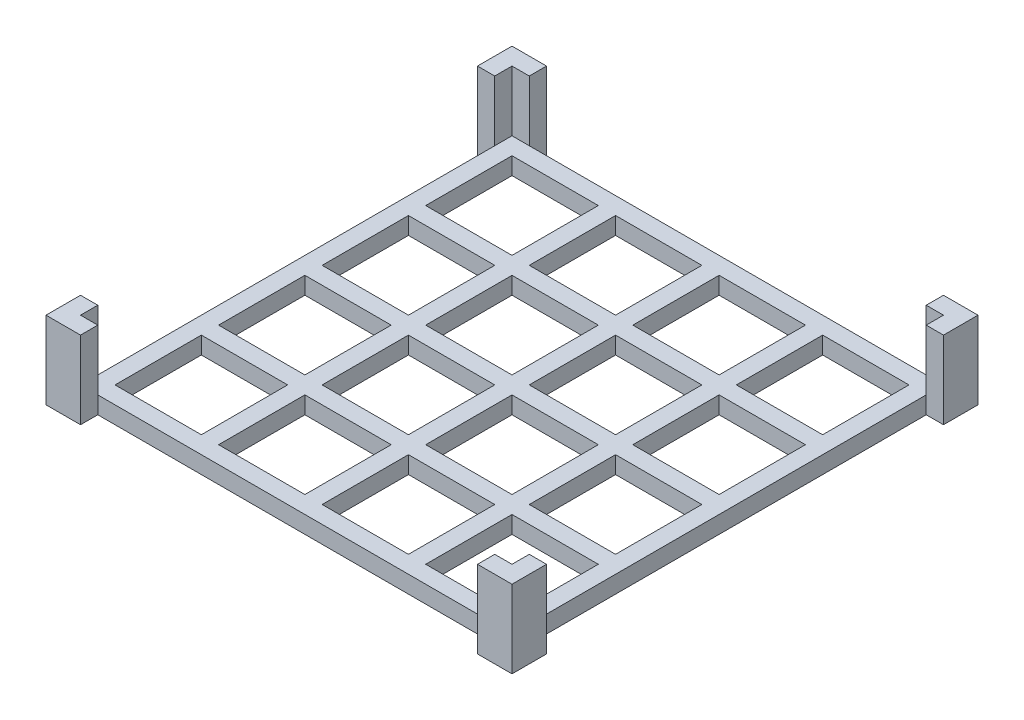
from build123d import *

# Parameters (mm, degrees)
BOSS_EXTRUDE16_START   = 2
BOSS_EXTRUDE16_DEPTH   = 9
BOSS_EXTRUDE16_2_DEPTH = 9
BOSS_EXTRUDE16_3_DEPTH = 9
BOSS_EXTRUDE16_4_DEPTH = 9
BOSS_EXTRUDE17_START   = 2
SKETCH1_28_W           = 10
SKETCH1_28_H           = 10
BOSS_EXTRUDE17_DEPTH   = 2


with BuildPart() as part:
    # Sketch1 → Boss-Extrude16 (new body)
    with BuildSketch(Plane(origin=(0, 0, 0), x_dir=(1, 0, 0), z_dir=(0, 1, 0)).offset(BOSS_EXTRUDE16_START)):
        Polygon((-44, 31), (-42, 31), (-42, 33), (-46, 33), (-46, 29), (-44, 29), align=None)
    extrude(amount=BOSS_EXTRUDE16_DEPTH)



with BuildPart() as body_2:
    # Sketch1 → Boss-Extrude16 2 (new body)
    with BuildSketch(Plane(origin=(0, 0, 0), x_dir=(1, 0, 0), z_dir=(0, 1, 0)).offset(BOSS_EXTRUDE16_START)):
        Polygon((4, 33), (4, 31), (6, 31), (6, 29), (8, 29), (8, 33), align=None)
    extrude(amount=BOSS_EXTRUDE16_2_DEPTH)


with BuildPart() as body_3:
    # Sketch1 → Boss-Extrude16 3 (new body)
    with BuildSketch(Plane(origin=(0, 0, 0), x_dir=(1, 0, 0), z_dir=(0, 1, 0)).offset(BOSS_EXTRUDE16_START)):
        Polygon((-44, -19), (-44, -17), (-46, -17), (-46, -21), (-42, -21), (-42, -19), align=None)
    extrude(amount=BOSS_EXTRUDE16_3_DEPTH)


with BuildPart() as body_4:
    # Sketch1 → Boss-Extrude16 4 (new body)
    with BuildSketch(Plane(origin=(0, 0, 0), x_dir=(1, 0, 0), z_dir=(0, 1, 0)).offset(BOSS_EXTRUDE16_START)):
        Polygon((8, -17), (6, -17), (6, -19), (4, -19), (4, -21), (8, -21), align=None)
    extrude(amount=BOSS_EXTRUDE16_4_DEPTH)


with BuildPart() as part_1:
    add(part.part)

    add(body_2.part)  # Boss-Extrude17 merges body 2

    add(body_3.part)  # Boss-Extrude17 merges body 3

    add(body_4.part)  # Boss-Extrude17 merges body 4
    # Sketch1<28> → Boss-Extrude17 (add)
    with BuildSketch(Plane(origin=(0, 0, 0), x_dir=(1, 0, 0), z_dir=(0, 1, 0)).offset(BOSS_EXTRUDE17_START)):
        Polygon((4, 31), (-42, 31), (-44, 31), (-44, 29), (-44, -17), (-44, -19), (-42, -19), (4, -19), (6, -19), (6, -17), (6, 29), (6, 31), align=None)
        with Locations((-37, -12)):
            Rectangle(SKETCH1_28_W, SKETCH1_28_H, mode=Mode.SUBTRACT)
        with Locations((-25, -12)):
            Rectangle(SKETCH1_28_W, SKETCH1_28_H, mode=Mode.SUBTRACT)
        with Locations((-37, 0)):
            Rectangle(SKETCH1_28_W, SKETCH1_28_H, mode=Mode.SUBTRACT)
        with Locations((-25, 0)):
            Rectangle(SKETCH1_28_W, SKETCH1_28_H, mode=Mode.SUBTRACT)
        with Locations((-13, -12)):
            Rectangle(SKETCH1_28_W, SKETCH1_28_H, mode=Mode.SUBTRACT)
        with Locations((-1, -12)):
            Rectangle(SKETCH1_28_W, SKETCH1_28_H, mode=Mode.SUBTRACT)
        with Locations((-13, 0)):
            Rectangle(SKETCH1_28_W, SKETCH1_28_H, mode=Mode.SUBTRACT)
        with Locations((-1, 0)):
            Rectangle(SKETCH1_28_W, SKETCH1_28_H, mode=Mode.SUBTRACT)
        with Locations((-37, 12)):
            Rectangle(SKETCH1_28_W, SKETCH1_28_H, mode=Mode.SUBTRACT)
        with Locations((-25, 12)):
            Rectangle(SKETCH1_28_W, SKETCH1_28_H, mode=Mode.SUBTRACT)
        with Locations((-37, 24)):
            Rectangle(SKETCH1_28_W, SKETCH1_28_H, mode=Mode.SUBTRACT)
        with Locations((-25, 24)):
            Rectangle(SKETCH1_28_W, SKETCH1_28_H, mode=Mode.SUBTRACT)
        with Locations((-13, 12)):
            Rectangle(SKETCH1_28_W, SKETCH1_28_H, mode=Mode.SUBTRACT)
        with Locations((-1, 12)):
            Rectangle(SKETCH1_28_W, SKETCH1_28_H, mode=Mode.SUBTRACT)
        with Locations((-13, 24)):
            Rectangle(SKETCH1_28_W, SKETCH1_28_H, mode=Mode.SUBTRACT)
        with Locations((-1, 24)):
            Rectangle(SKETCH1_28_W, SKETCH1_28_H, mode=Mode.SUBTRACT)
    extrude(amount=BOSS_EXTRUDE17_DEPTH)


solid = part_1.part
